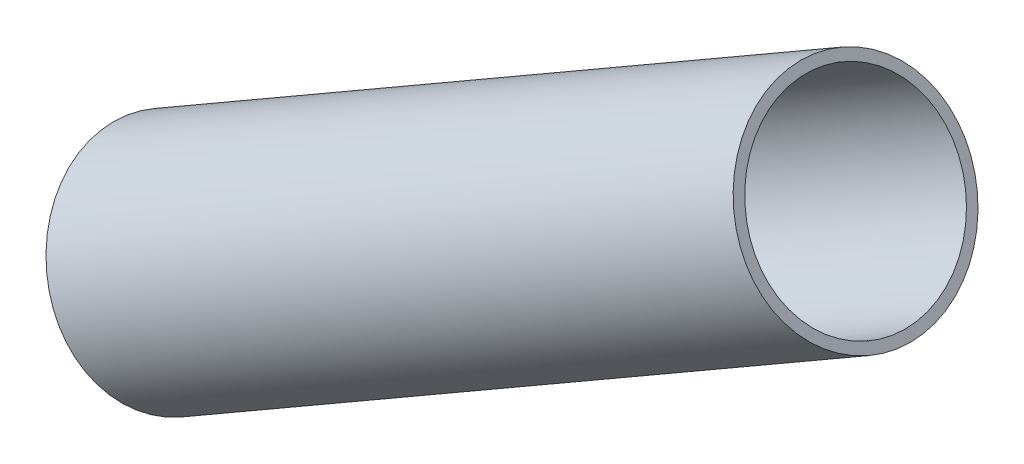
from build123d import *

# Parameters (mm, degrees)
SKETCH2_R   = 84.1375
SKETCH2_R_2 = 76.2


with BuildPart() as part:
    # Sweep1: sweep along a path in Sketch1
    with BuildLine(Plane.XY) as sweep1_path:
        Line((0, 0), (-527.929086147, -304.8))
    # Sketch2 → Sweep1 (sweep)
    with BuildSketch(Plane(origin=(0, 0, 0), x_dir=(0, 0, 1), z_dir=(-0.8660254037844379, -0.5000000000000013, 0))):
        Circle(SKETCH2_R)
        Circle(SKETCH2_R_2, mode=Mode.SUBTRACT)
    sweep(path=sweep1_path.line)


solid = part.part
